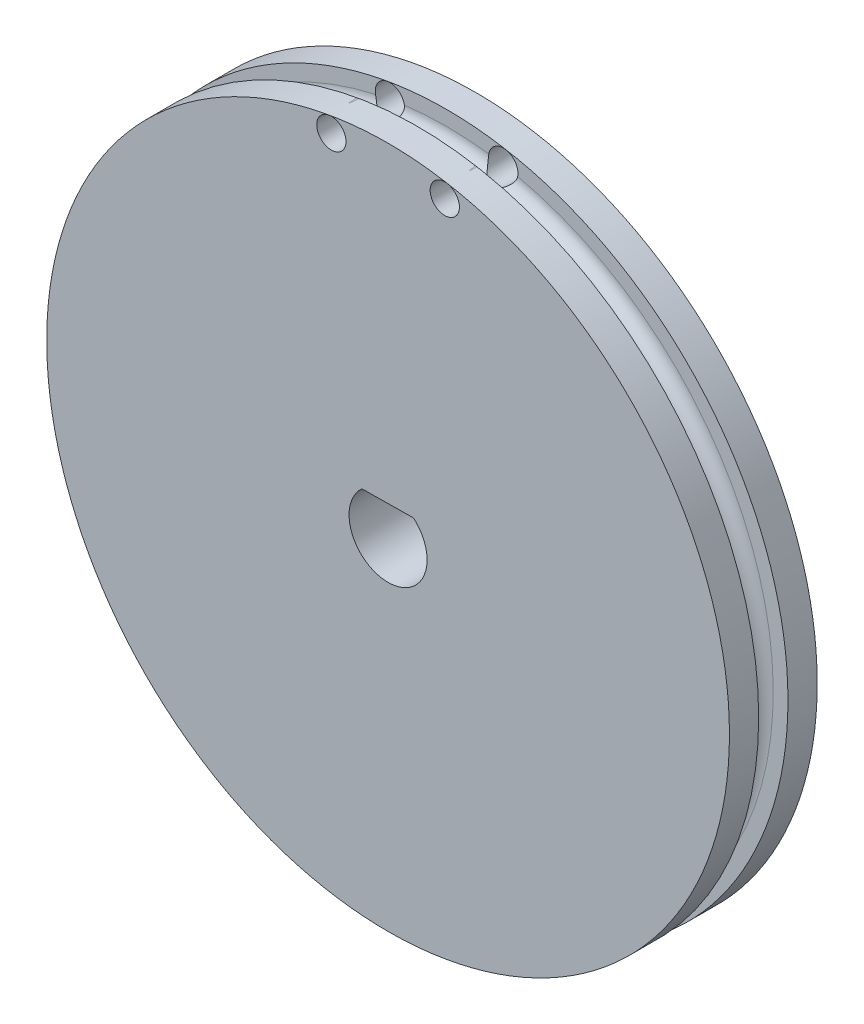
from build123d import *

# Parameters (mm, degrees)
CUT_EXTRUDE1_DEPTH  = 9
SKETCH4_R           = 1.5
CUT_EXTRUDE10_DEPTH = 33.49


with BuildPart() as part:
    # Sketch2 → Revolve1 (revolve)
    with BuildSketch(Plane(origin=(0, 0, 0), x_dir=(0, 0, -1), z_dir=(1, 0, 0)), mode=Mode.PRIVATE) as revolve1_sk:
        with BuildLine():
            Line((-4.572036915, 0), (4.427963085, 0))
            Line((4.427963085, 0), (4.427963085, 35))
            Line((4.427963085, 35), (1.427963085, 35))
            Line((1.427963085, 35), (1.427963085, 33.49))
            ThreePointArc((1.427963085, 33.49), (-0.072036915, 31.99), (-1.572036915, 33.49))
            Line((-1.572036915, 33.49), (-1.572036915, 35))
            Line((-1.572036915, 35), (-4.572036915, 35))
            Line((-4.572036915, 35), (-4.572036915, 0))
        make_face()
    revolve(revolve1_sk.sketch.rotate(Axis((0, 0, 4.572036915), (0, 0, -1)), 90), axis=Axis((0, 0, 4.572036915), (0, 0, -1)))

    # Sketch3 → Cut-Extrude1 (cut)
    with BuildSketch(Plane(origin=(0, 0, -4.427963085), x_dir=(-1, 0, 0), z_dir=(0, 0, -1))):
        with BuildLine():
            Line((-2.613191437, 3.028403955), (2.678002471, 2.971245996))
            ThreePointArc((2.678002471, 2.971245996), (-0.043207356, -3.999766634), (-2.613191437, 3.028403955))
        make_face()
    extrude(amount=-CUT_EXTRUDE1_DEPTH, mode=Mode.SUBTRACT)

    # Sketch4 → Cut-Extrude10 (cut)
    with BuildSketch(Plane(origin=(0, 0, -4.427963085), x_dir=(-1, 0, 0), z_dir=(0, 0, -1))):
        with Locations((-5.81547747, 32.981211648)):
            Circle(SKETCH4_R)
        with Locations((5.81547747, 32.981211648)):
            Circle(SKETCH4_R)
    extrude(amount=-CUT_EXTRUDE10_DEPTH, mode=Mode.SUBTRACT)


solid = part.part
